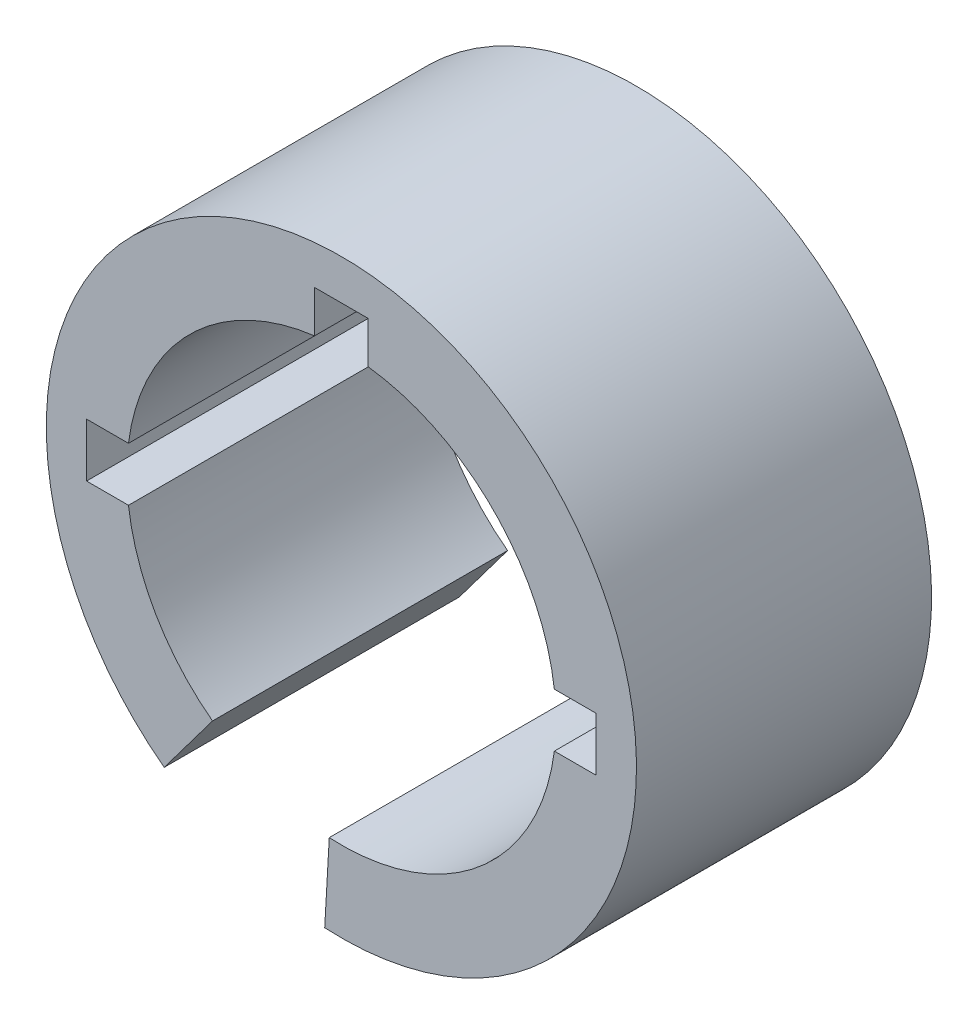
from build123d import *

# Parameters (mm, degrees)
BOSS_EXTRUDE1_DEPTH = 5.5
CUT_EXTRUDE1_START  = -5.5
CUT_EXTRUDE1_DEPTH  = 5.5


with BuildPart() as part:
    # Sketch1 → Boss-Extrude1 (new body)
    with BuildSketch(Plane.XY):
        with BuildLine():
            Line((-0.226235298, -3.993597074), (-0.311073535, -5.491195977))
            ThreePointArc((-0.311073535, -5.491195977), (1.887741114, 5.165891355), (-3.302674289, -4.397993013))
            Line((-3.302674289, -4.397993013), (-2.401944937, -3.198540373))
            ThreePointArc((-2.401944937, -3.198540373), (1.372902628, 3.757011894), (-0.226235298, -3.993597074))
        make_face()
    extrude(amount=BOSS_EXTRUDE1_DEPTH)

    # Sketch2 → Cut-Extrude1 (cut)
    with BuildSketch(Plane.XY.offset(5.5).offset(CUT_EXTRUDE1_START)):
        with BuildLine():
            Line((-0.5, 4.75), (-0.5, 3.968626967))
            ThreePointArc((-0.5, 3.968626967), (0, 4), (0.5, 3.968626967))
            Line((0.5, 3.968626967), (0.5, 4.75))
            Line((0.5, 4.75), (-0.5, 4.75))
        make_face()
        with BuildLine():
            Line((-3.968626967, 0.5), (-4.75, 0.5))
            Line((-4.75, 0.5), (-4.75, -0.5))
            Line((-4.75, -0.5), (-3.968626967, -0.5))
            ThreePointArc((-3.968626967, -0.5), (-4, 0), (-3.968626967, 0.5))
        make_face()
        with BuildLine():
            Line((4.75, 0.5), (3.968626967, 0.5))
            ThreePointArc((3.968626967, 0.5), (4, 0), (3.968626967, -0.5))
            Line((3.968626967, -0.5), (4.75, -0.5))
            Line((4.75, -0.5), (4.75, 0.5))
        make_face()
    extrude(amount=CUT_EXTRUDE1_DEPTH, mode=Mode.SUBTRACT)


solid = part.part
